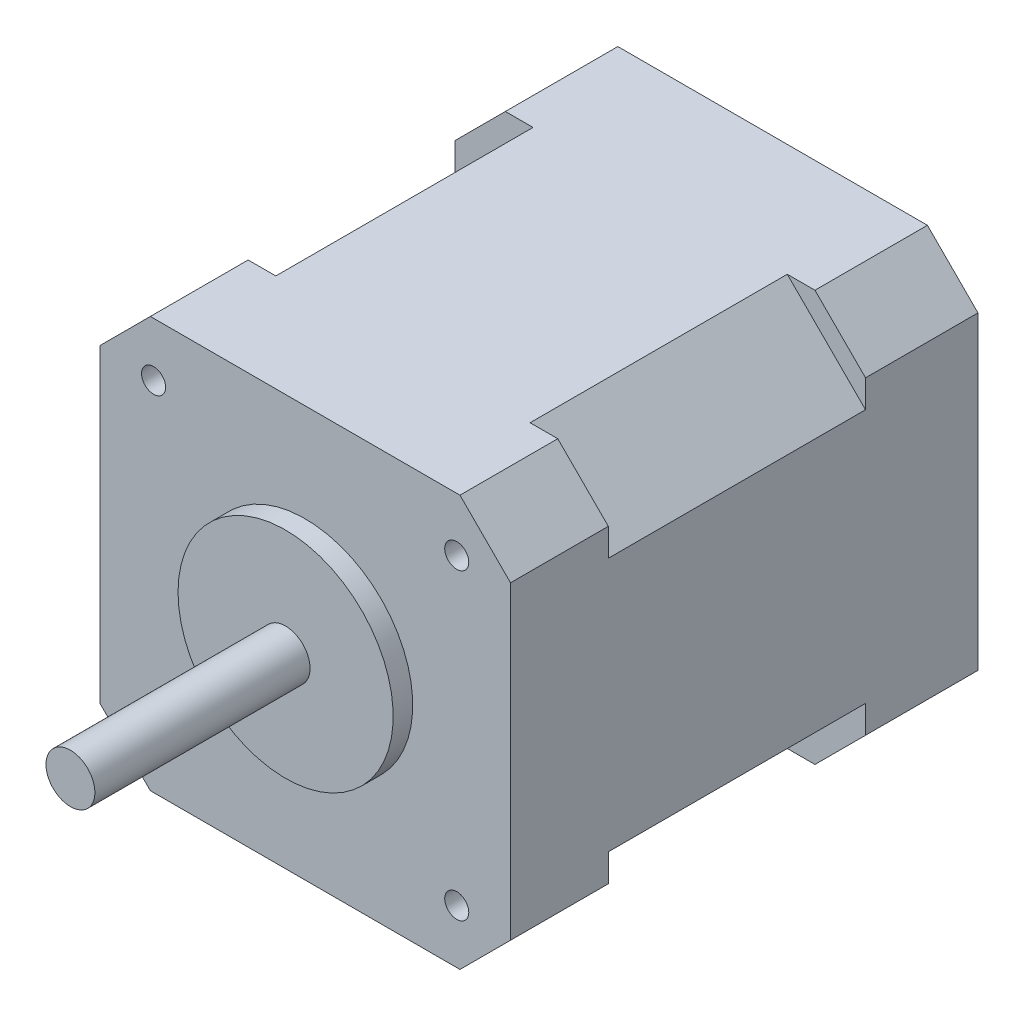
from build123d import *

# Parameters (mm, degrees)
BOSS_EXTRUDE1_DEPTH = 11.5
BOSS_EXTRUDE2_DEPTH = 26.3
BOSS_EXTRUDE3_DEPTH = 10
SKETCH4_W           = 10
SKETCH4_H           = 0.6
SKETCH5_W           = 10
SKETCH5_H           = 0.6
SKETCH6_W           = 10
SKETCH6_H           = 0.6
SKETCH7_W           = 10
SKETCH7_H           = 0.6
HOLE1_D             = 2.459
HOLE1_DEPTH         = 5
HOLE2_D             = 2.459
HOLE2_DEPTH         = 5
HOLE3_D             = 2.459
HOLE3_DEPTH         = 5
HOLE4_D             = 2.459
HOLE4_DEPTH         = 5


with BuildPart() as part:
    # Sketch1 → Boss-Extrude1 (new body)
    with BuildSketch(Plane(origin=(0, 0, 0), x_dir=(-1, 0, 0), z_dir=(0, 0, -1))):
        Polygon((-15.828427125, 21), (-21, 15.828427125), (-21, -15.828427125), (-15.828427125, -21), (15.828427125, -21), (21, -15.828427125), (21, 15.828427125), (15.828427125, 21), align=None)
    extrude(amount=-BOSS_EXTRUDE1_DEPTH)

    # Sketch2 → Boss-Extrude2 (add)
    with BuildSketch(Plane.XY.offset(11.5)):
        Polygon((13, -21), (-13, -21), (-21, -13), (-21, 13), (-13, 21), (13, 21), (21, 13), (21, -13), align=None)
    extrude(amount=BOSS_EXTRUDE2_DEPTH)

    # Sketch3 → Boss-Extrude3 (add)
    with BuildSketch(Plane.XY.offset(37.8)):
        Polygon((15.828427125, 21), (21, 15.828427125), (21, -15.828427125), (15.828427125, -21), (-15.828427125, -21), (-21, -15.828427125), (-21, 15.828427125), (-15.828427125, 21), align=None)
    extrude(amount=BOSS_EXTRUDE3_DEPTH)

    # Sketch4 → Revolve1 (revolve)
    with BuildSketch(Plane.XY.offset(3.65)):
        with Locations((-26, 0.95)):
            Rectangle(SKETCH4_W, SKETCH4_H)
    revolve(axis=Axis((-31, 0.65, 3.65), (1, 0, 0)))

    # Sketch5 → Revolve2 (revolve)
    with BuildSketch(Plane.XY.offset(3.65)):
        with Locations((-26, -0.35)):
            Rectangle(SKETCH5_W, SKETCH5_H)
    revolve(axis=Axis((-31, -0.65, 3.65), (1, 0, 0)))

    # Sketch6 → Revolve3 (revolve)
    with BuildSketch(Plane.XY.offset(4.95)):
        with Locations((-26, -0.35)):
            Rectangle(SKETCH6_W, SKETCH6_H)
    revolve(axis=Axis((-31, -0.65, 4.95), (1, 0, 0)))

    # Sketch7 → Revolve4 (revolve)
    with BuildSketch(Plane.XY.offset(4.95)):
        with Locations((-26, 0.95)):
            Rectangle(SKETCH7_W, SKETCH7_H)
    revolve(axis=Axis((-31, 0.65, 4.95), (1, 0, 0)))

    # Sketch8 → Revolve5 (revolve)
    with BuildSketch(Plane.XZ, mode=Mode.PRIVATE) as revolve5_sk:
        Polygon((2.5, 71.8), (0, 71.8), (0, 47.8), (11, 47.8), (11, 49.8), (2.5, 49.8), align=None)
    revolve(revolve5_sk.sketch.rotate(Axis((0, 0, 71.8), (0, 0, -1)), 180), axis=Axis((0, 0, 71.8), (0, 0, -1)))

    # Hole1
    with Locations(Plane.XY.offset(47.8)):
        with Locations((-15.5, 15.5)):
            Hole(HOLE1_D / 2, depth=HOLE1_DEPTH)

    # Hole2
    with Locations(Plane.XY.offset(47.8)):
        with Locations((-15.5, -15.5)):
            Hole(HOLE2_D / 2, depth=HOLE2_DEPTH)

    # Hole3
    with Locations(Plane.XY.offset(47.8)):
        with Locations((15.5, 15.5)):
            Hole(HOLE3_D / 2, depth=HOLE3_DEPTH)

    # Hole4
    with Locations(Plane.XY.offset(47.8)):
        with Locations((15.5, -15.5)):
            Hole(HOLE4_D / 2, depth=HOLE4_DEPTH)


solid = part.part
